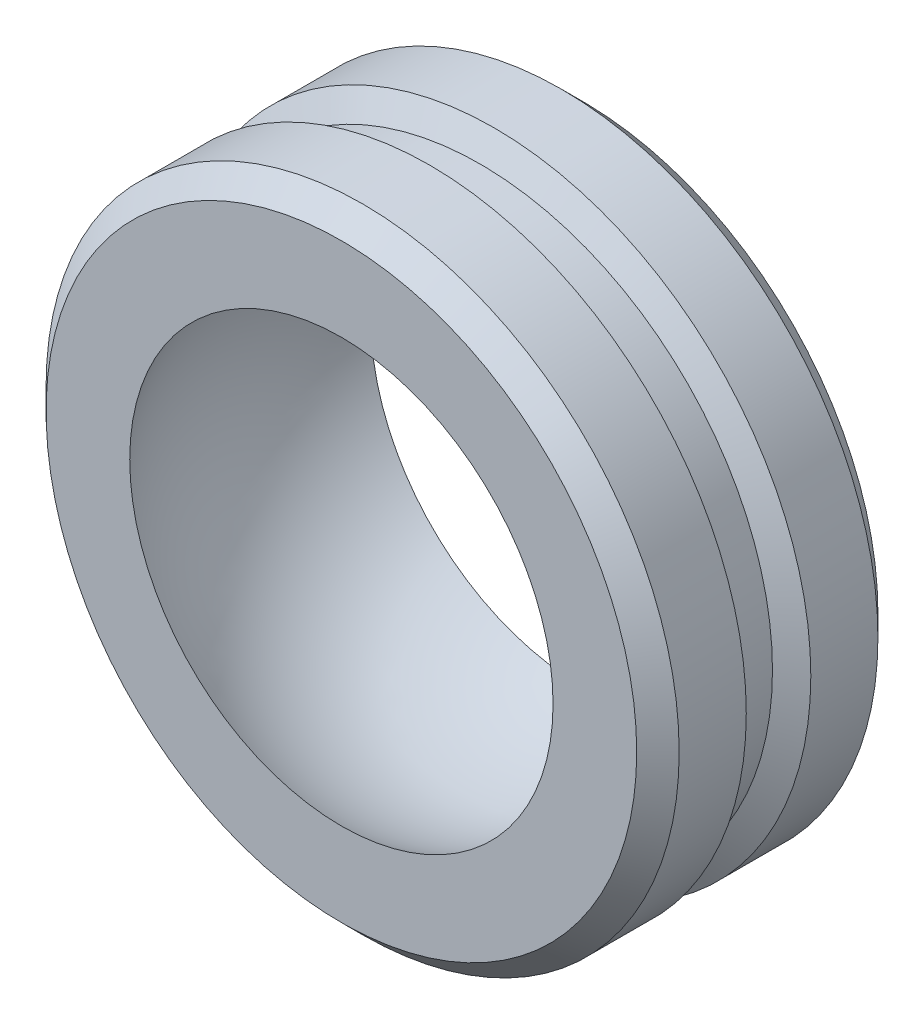
from build123d import *

# Parameters (mm, degrees)
SKETCH1_R               = 8.33374
EXTRUDE1_DEPTH          = 3.175
CUT_EXTRUDE1_DEPTH      = 14.417728087
CUT_EXTRUDE1_DEPTH_BACK = 14.417728087
SKETCH4_R               = 3.175
CUT_EXTRUDE2_DEPTH      = 14.417728087
CUT_EXTRUDE2_DEPTH_BACK = 14.417728087
SKETCH5_W               = 1.143161314
SKETCH5_H               = 16.66748
CHAMFER1_SIZE           = 0.5588


with BuildPart() as part:
    # Sketch1 → Extrude1 (new, symmetric)
    with BuildSketch(Plane.XY):
        Circle(SKETCH1_R)
    extrude(amount=EXTRUDE1_DEPTH, both=True)

    # Sketch2 → Cut-Revolve1 (revolve, cut)
    with BuildSketch(Plane.XY):
        with BuildLine():
            Line((0, 6.4135), (0, -6.4135))
            ThreePointArc((0, -6.4135), (6.4135, 0), (0, 6.4135))
        make_face()
    revolve(axis=Axis((0, 6.4135, 0), (0, 1, 0)), mode=Mode.SUBTRACT)

    # Chamfer1
    chamfer1_edges = [part.edges().sort_by_distance(p)[0] for p in [
        (-8.33374, 0, -3.175),
        (-8.33374, 0, 3.175),
    ]]
    chamfer(chamfer1_edges, length=CHAMFER1_SIZE)

    # Sketch8 → Cut-Revolve2 (revolve, cut)
    with BuildSketch(Plane(origin=(0, 0, 0), x_dir=(0, 0, -1), z_dir=(1, 0, 0)), mode=Mode.PRIVATE) as cut_revolve2_sk:
        Polygon((-0.84961036, 8.33374), (-0.48006, 7.69366), (0.48006, 7.69366), (0.84961036, 8.33374), align=None)
    revolve(cut_revolve2_sk.sketch.rotate(Axis((0, 0, 0), (0, 0, -1)), 90), axis=Axis((0, 0, 0), (0, 0, -1)), mode=Mode.SUBTRACT)


with BuildPart() as body_2:
    # Sketch3 → Revolve1 (revolve)
    with BuildSketch(Plane.XY):
        with BuildLine():
            Line((0, 6.35), (0, -6.35))
            ThreePointArc((0, -6.35), (6.35, 0), (0, 6.35))
        make_face()
    revolve(axis=Axis((0, 6.35, 0), (0, 1, 0)))

    # Sketch4 → Cut-Extrude1 (cut, two sides: drawn at the far end of the back side and taken through both)
    with BuildSketch(Plane.XY.offset(-CUT_EXTRUDE1_DEPTH_BACK)):
        with Locations(Location((0, 0, 0), (0, 0, 180))):
            Circle(SKETCH4_R)
    extrude(amount=CUT_EXTRUDE1_DEPTH + CUT_EXTRUDE1_DEPTH_BACK, mode=Mode.SUBTRACT)

    # Sketch5 → Cut-Extrude2 (cut, two sides: drawn at the far end of the back side and taken through both)
    with BuildSketch(Plane(origin=(0, 0, 0), x_dir=(0, 0, -1), z_dir=(1, 0, 0)).offset(-CUT_EXTRUDE2_DEPTH_BACK)):
        with Locations((-4.927680657, 0)):
            Rectangle(SKETCH5_W, SKETCH5_H)
        with Locations((4.927680657, 0)):
            Rectangle(SKETCH5_W, SKETCH5_H)
    extrude(amount=CUT_EXTRUDE2_DEPTH + CUT_EXTRUDE2_DEPTH_BACK, mode=Mode.SUBTRACT)


solid = part.part
